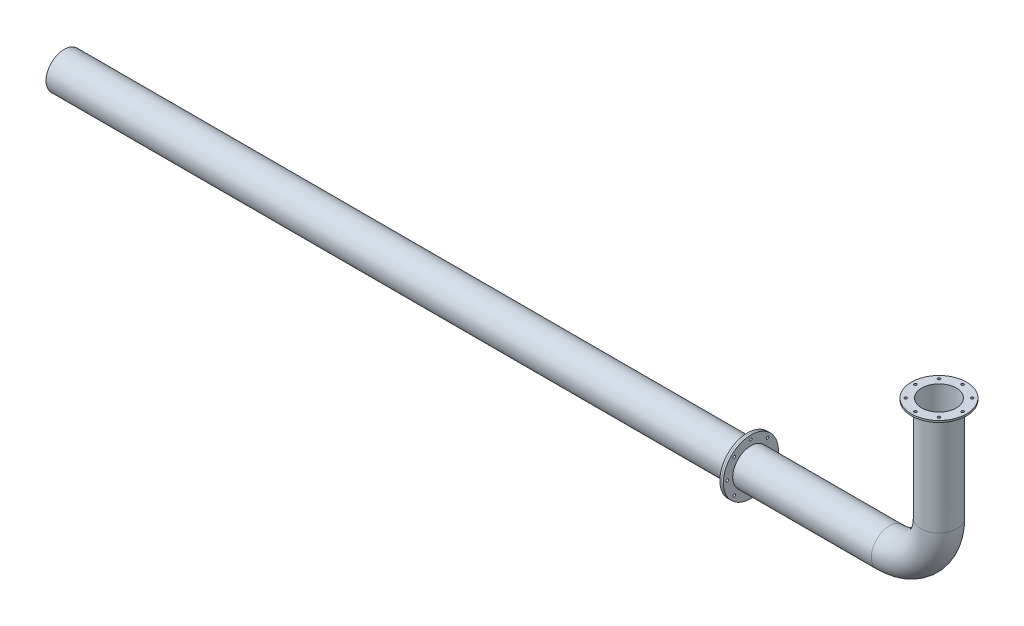
from build123d import *
from build123d.topology import SkipClean

# Parameters (mm, degrees)
SKETCH1_R           = 127.5
SKETCH1_R_2         = 6
SKETCH1_R_3         = 80
BOSS_EXTRUDE1_DEPTH = 8
BOSS_EXTRUDE2_START = 473.1
SKETCH2_R           = 84
SKETCH2_R_2         = 80
BOSS_EXTRUDE2_DEPTH = 473.1
SKETCH3_R           = 84
SKETCH3_R_2         = 80
SKETCH6_R           = 84
SKETCH6_R_2         = 80
BOSS_EXTRUDE3_DEPTH = 640.58
SKETCH7_R           = 127.5
SKETCH7_R_2         = 80
SKETCH7_R_3         = 6
BOSS_EXTRUDE4_DEPTH = 8
SKETCH8_R           = 127.5
SKETCH8_R_2         = 6
SKETCH8_R_3         = 80
BOSS_EXTRUDE5_DEPTH = 8
SKETCH9_R           = 84
SKETCH9_R_2         = 80
BOSS_EXTRUDE6_DEPTH = 3157


with BuildPart() as part:
    # Sketch1 → Boss-Extrude1 (new body)
    with BuildSketch(Plane(origin=(0, 0, 0), x_dir=(1, 0, 0), z_dir=(0, 1, 0))):
        with Locations(Location((0, 0, 0), (0, 0, 270))):
            Circle(SKETCH1_R)
        with Locations(Location((0, 109, 0), (0, 0, 270))):
            Circle(SKETCH1_R_2, mode=Mode.SUBTRACT)
        with Locations(Location((0, 0, 0), (0, 0, 270))):
            Circle(SKETCH1_R_3, mode=Mode.SUBTRACT)
        with Locations(Location((77.074639149, 77.074639149, 0), (0, 0, 270))):
            Circle(SKETCH1_R_2, mode=Mode.SUBTRACT)
        with Locations(Location((109, 0, 0), (0, 0, 270))):
            Circle(SKETCH1_R_2, mode=Mode.SUBTRACT)
        with Locations(Location((77.074639149, -77.074639149, 0), (0, 0, 270))):
            Circle(SKETCH1_R_2, mode=Mode.SUBTRACT)
        with Locations(Location((0, -109, 0), (0, 0, 270))):
            Circle(SKETCH1_R_2, mode=Mode.SUBTRACT)
        with Locations(Location((-77.074639149, -77.074639149, 0), (0, 0, 270))):
            Circle(SKETCH1_R_2, mode=Mode.SUBTRACT)
        with Locations(Location((-109, 0, 0), (0, 0, 270))):
            Circle(SKETCH1_R_2, mode=Mode.SUBTRACT)
        with Locations(Location((-77.074639149, 77.074639149, 0), (0, 0, 270))):
            Circle(SKETCH1_R_2, mode=Mode.SUBTRACT)
    extrude(amount=BOSS_EXTRUDE1_DEPTH)

    # Sketch2 → Boss-Extrude2 (add)
    with SkipClean():  # the faces are left unmerged after this step: merging them gives an invalid solid
        with BuildSketch(Plane.XZ.offset(BOSS_EXTRUDE2_START)):
            with Locations(Location((0, 0, 0), (0, 0, 90))):
                Circle(SKETCH2_R)
            with Locations(Location((0, 0, 0), (0, 0, 270))):
                Circle(SKETCH2_R_2, mode=Mode.SUBTRACT)
        extrude(amount=-BOSS_EXTRUDE2_DEPTH)

    # Sweep1: sweep along a path in Sketch5
    with SkipClean():  # the faces are left unmerged after this step: merging them gives an invalid solid
        with BuildLine(Plane.XY) as sweep1_path:
            ThreePointArc((0, -473.1), (-66.955389821, -634.744610179), (-228.6, -701.7))
        # Sketch3 → Sweep1 (sweep)
        with BuildSketch(Plane.XZ.offset(473.1)):
            Circle(SKETCH3_R)
            Circle(SKETCH3_R_2, mode=Mode.SUBTRACT)
        sweep(path=sweep1_path.line)

    # Sketch6 → Boss-Extrude3 (add)
    with SkipClean():  # the faces are left unmerged after this step: merging them gives an invalid solid
        with BuildSketch(Plane.ZY.offset(228.6)):
            with Locations(Location((0, -701.7, 0), (0, 0, 270))):
                Circle(SKETCH6_R)
            with Locations(Location((0, -701.7, 0), (0, 0, 270))):
                Circle(SKETCH6_R_2, mode=Mode.SUBTRACT)
        extrude(amount=BOSS_EXTRUDE3_DEPTH)

    # Sketch7 → Boss-Extrude4 (add)
    with SkipClean():  # the faces are left unmerged after this step: merging them gives an invalid solid
        with BuildSketch(Plane.ZY.offset(869.18)):
            with Locations(Location((0, -701.7, 0), (0, 0, 270))):
                Circle(SKETCH7_R)
            with Locations(Location((0, -701.7, 0), (0, 0, 270))):
                Circle(SKETCH7_R_2, mode=Mode.SUBTRACT)
            with Locations(Location((0, -592.7, 0), (0, 0, 270))):
                Circle(SKETCH7_R_3, mode=Mode.SUBTRACT)
            with Locations(Location((77.074639149, -624.625360851, 0), (0, 0, 270))):
                Circle(SKETCH7_R_3, mode=Mode.SUBTRACT)
            with Locations(Location((109, -701.7, 0), (0, 0, 270))):
                Circle(SKETCH7_R_3, mode=Mode.SUBTRACT)
            with Locations(Location((77.074639149, -778.774639149, 0), (0, 0, 270))):
                Circle(SKETCH7_R_3, mode=Mode.SUBTRACT)
            with Locations(Location((0, -810.7, 0), (0, 0, 270))):
                Circle(SKETCH7_R_3, mode=Mode.SUBTRACT)
            with Locations(Location((-77.074639149, -778.774639149, 0), (0, 0, 270))):
                Circle(SKETCH7_R_3, mode=Mode.SUBTRACT)
            with Locations(Location((-109, -701.7, 0), (0, 0, 270))):
                Circle(SKETCH7_R_3, mode=Mode.SUBTRACT)
            with Locations(Location((-77.074639149, -624.625360851, 0), (0, 0, 270))):
                Circle(SKETCH7_R_3, mode=Mode.SUBTRACT)
        extrude(amount=BOSS_EXTRUDE4_DEPTH)


with BuildPart() as body_2:
    # Sketch8 → Boss-Extrude5 (new body)
    with BuildSketch(Plane.ZY.offset(877.18)):
        with Locations(Location((0, -701.7, 0), (0, 0, 270))):
            Circle(SKETCH8_R)
        with Locations(Location((-109, -701.7, 0), (0, 0, 270))):
            Circle(SKETCH8_R_2, mode=Mode.SUBTRACT)
        with Locations(Location((-77.074639149, -624.625360851, 0), (0, 0, 270))):
            Circle(SKETCH8_R_2, mode=Mode.SUBTRACT)
        with Locations(Location((0, -592.7, 0), (0, 0, 270))):
            Circle(SKETCH8_R_2, mode=Mode.SUBTRACT)
        with Locations(Location((77.074639149, -624.625360851, 0), (0, 0, 270))):
            Circle(SKETCH8_R_2, mode=Mode.SUBTRACT)
        with Locations(Location((109, -701.7, 0), (0, 0, 270))):
            Circle(SKETCH8_R_2, mode=Mode.SUBTRACT)
        with Locations(Location((77.074639149, -778.774639149, 0), (0, 0, 270))):
            Circle(SKETCH8_R_2, mode=Mode.SUBTRACT)
        with Locations(Location((0, -810.7, 0), (0, 0, 270))):
            Circle(SKETCH8_R_2, mode=Mode.SUBTRACT)
        with Locations(Location((-77.074639149, -778.774639149, 0), (0, 0, 270))):
            Circle(SKETCH8_R_2, mode=Mode.SUBTRACT)
        with Locations(Location((0, -701.7, 0), (0, 0, 270))):
            Circle(SKETCH8_R_3, mode=Mode.SUBTRACT)
    extrude(amount=BOSS_EXTRUDE5_DEPTH)

    # Sketch9 → Boss-Extrude6 (add)
    with BuildSketch(Plane.ZY.offset(885.18)):
        with Locations(Location((0, -701.7, 0), (0, 0, 270))):
            Circle(SKETCH9_R)
        with Locations(Location((0, -701.7, 0), (0, 0, 270))):
            Circle(SKETCH9_R_2, mode=Mode.SUBTRACT)
    extrude(amount=BOSS_EXTRUDE6_DEPTH)


solid = Compound([part.part, body_2.part])
